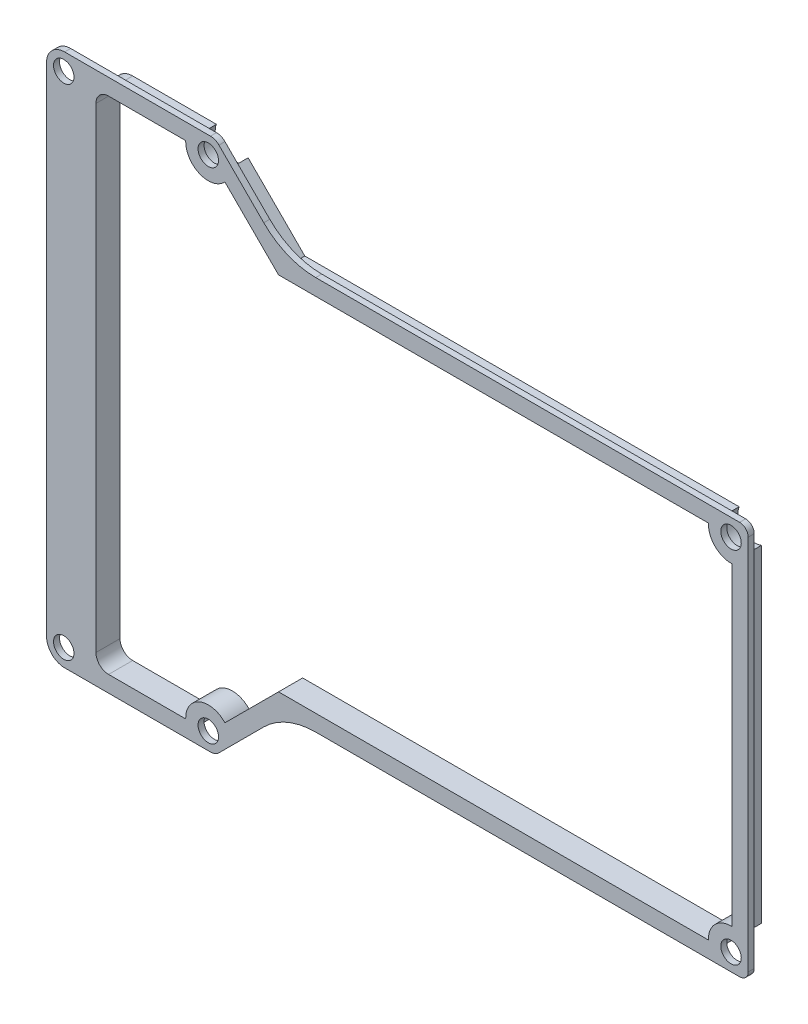
from build123d import *

# Parameters (mm, degrees)
SKETCH2_R           = 1.7
BOSS_EXTRUDE1_DEPTH = 1
BOSS_EXTRUDE2_START = -3
BOSS_EXTRUDE2_DEPTH = 3


with BuildPart() as part:
    # Sketch2 → Boss-Extrude1 (new body)
    with BuildSketch(Plane.XY):
        with BuildLine():
            Line((28.78011557, -21.498473491), (21.333027704, -14.051385626))
            ThreePointArc((21.333027704, -14.051385626), (20.684181007, -13.617840123), (19.918814142, -13.465599188))
            Line((19.918814142, -13.465599188), (-4.3, -13.465599188))
            ThreePointArc((-4.3, -13.465599188), (-6.421320344, -14.344278845), (-7.3, -16.465599188))
            Line((-7.3, -16.465599188), (-7.3, -99.073599188))
            ThreePointArc((-7.3, -99.073599188), (-6.421320344, -101.194919532), (-4.3, -102.073599188))
            Line((-4.3, -102.073599188), (19.918814142, -102.073599188))
            ThreePointArc((19.918814142, -102.073599188), (20.684181007, -101.921358253), (21.333027704, -101.48781275))
            Line((21.333027704, -101.48781275), (28.78511557, -94.035724885))
            ThreePointArc((28.78511557, -94.035724885), (32.741782732, -91.39196441), (37.408989873, -90.463599188))
            Line((37.408989873, -90.463599188), (107.834, -90.463599188))
            ThreePointArc((107.834, -90.463599188), (108.841627163, -90.046226351), (109.259, -89.038599188))
            Line((109.259, -89.038599188), (109.259, -26.495599188))
            ThreePointArc((109.259, -26.495599188), (108.841627163, -25.487972025), (107.834, -25.070599188))
            Line((107.834, -25.070599188), (37.403989873, -25.070599188))
            ThreePointArc((37.403989873, -25.070599188), (32.736782732, -24.142233967), (28.78011557, -21.498473491))
        make_face()
        with Locations((106.406, -27.923599188)):
            Circle(SKETCH2_R, mode=Mode.SUBTRACT)
        with Locations((19.565489973, -16.318599188)):
            Circle(SKETCH2_R, mode=Mode.SUBTRACT)
        with Locations((-4.447, -16.318599188)):
            Circle(SKETCH2_R, mode=Mode.SUBTRACT)
        with Locations((-4.447, -99.220599188)):
            Circle(SKETCH2_R, mode=Mode.SUBTRACT)
        with Locations((19.565489973, -99.220599188)):
            Circle(SKETCH2_R, mode=Mode.SUBTRACT)
        with Locations((106.406, -87.610599188)):
            Circle(SKETCH2_R, mode=Mode.SUBTRACT)
        with BuildLine():
            Line((15.815448907, -99.369599188), (3, -99.369599188))
            ThreePointArc((3, -99.369599188), (1.51507576, -98.754523429), (0.9, -97.269599188))
            Line((0.9, -97.269599188), (0.9, -18.269599188))
            ThreePointArc((0.9, -18.269599188), (1.51507576, -16.784674948), (3, -16.169599188))
            Line((3, -16.169599188), (15.815448907, -16.169599188))
            ThreePointArc((15.815448907, -16.169599188), (18.129279051, -19.785919074), (22.322528351, -18.864919746))
            Line((22.322528351, -18.864919746), (31.232207794, -27.774599188))
            Line((31.232207794, -27.774599188), (102.655958934, -27.774599188))
            ThreePointArc((102.655958934, -27.774599188), (103.75222825, -30.577370938), (106.555, -31.673640255))
            Line((106.555, -31.673640255), (106.555, -83.860558122))
            ThreePointArc((106.555, -83.860558122), (103.75222825, -84.956827438), (102.655958934, -87.759599188))
            Line((102.655958934, -87.759599188), (31.237207794, -87.759599188))
            Line((31.237207794, -87.759599188), (22.322528351, -96.674278631))
            ThreePointArc((22.322528351, -96.674278631), (18.129279051, -95.753279303), (15.815448907, -99.369599188))
        make_face(mode=Mode.SUBTRACT)
    extrude(amount=BOSS_EXTRUDE1_DEPTH)

    # Sketch3 → Boss-Extrude2 (add)
    with BuildSketch(Plane.XY.offset(BOSS_EXTRUDE2_START)):
        with BuildLine():
            Line((31.605, -26.874599188), (103.75284942, -26.874599188))
            ThreePointArc((103.75284942, -26.874599188), (104.388624353, -29.940974835), (107.455, -30.576749768))
            Line((107.455, -30.576749768), (107.455, -84.957448608))
            ThreePointArc((107.455, -84.957448608), (104.388624353, -85.593223541), (103.75284942, -88.659599188))
            Line((103.75284942, -88.659599188), (31.61, -88.659599188))
            Line((31.61, -88.659599188), (22.183305753, -98.086293435))
            ThreePointArc((22.183305753, -98.086293435), (18.473694141, -96.584770882), (16.912339393, -100.269599188))
            Line((16.912339393, -100.269599188), (3, -100.269599188))
            ThreePointArc((3, -100.269599188), (0.878679656, -99.390919532), (0, -97.269599188))
            Line((0, -97.269599188), (0, -18.269599188))
            ThreePointArc((0, -18.269599188), (0.878679656, -16.148278845), (3, -15.269599188))
            Line((3, -15.269599188), (16.912339393, -15.269599188))
            ThreePointArc((16.912339393, -15.269599188), (18.473694141, -18.954427494), (22.183305753, -17.452904941))
            Line((22.183305753, -17.452904941), (31.605, -26.874599188))
        make_face()
        with BuildLine():
            Line((102.655958934, -27.774599188), (31.232207794, -27.774599188))
            Line((31.232207794, -27.774599188), (22.322528351, -18.864919746))
            ThreePointArc((22.322528351, -18.864919746), (18.129279051, -19.785919074), (15.815448907, -16.169599188))
            Line((15.815448907, -16.169599188), (3, -16.169599188))
            ThreePointArc((3, -16.169599188), (1.51507576, -16.784674948), (0.9, -18.269599188))
            Line((0.9, -18.269599188), (0.9, -97.269599188))
            ThreePointArc((0.9, -97.269599188), (1.51507576, -98.754523429), (3, -99.369599188))
            Line((3, -99.369599188), (15.815448907, -99.369599188))
            ThreePointArc((15.815448907, -99.369599188), (18.129279051, -95.753279303), (22.322528351, -96.674278631))
            Line((22.322528351, -96.674278631), (31.237207794, -87.759599188))
            Line((31.237207794, -87.759599188), (102.655958934, -87.759599188))
            ThreePointArc((102.655958934, -87.759599188), (103.75222825, -84.956827438), (106.555, -83.860558122))
            Line((106.555, -83.860558122), (106.555, -31.673640255))
            ThreePointArc((106.555, -31.673640255), (103.75222825, -30.577370938), (102.655958934, -27.774599188))
        make_face(mode=Mode.SUBTRACT)
    extrude(amount=BOSS_EXTRUDE2_DEPTH)


solid = part.part
